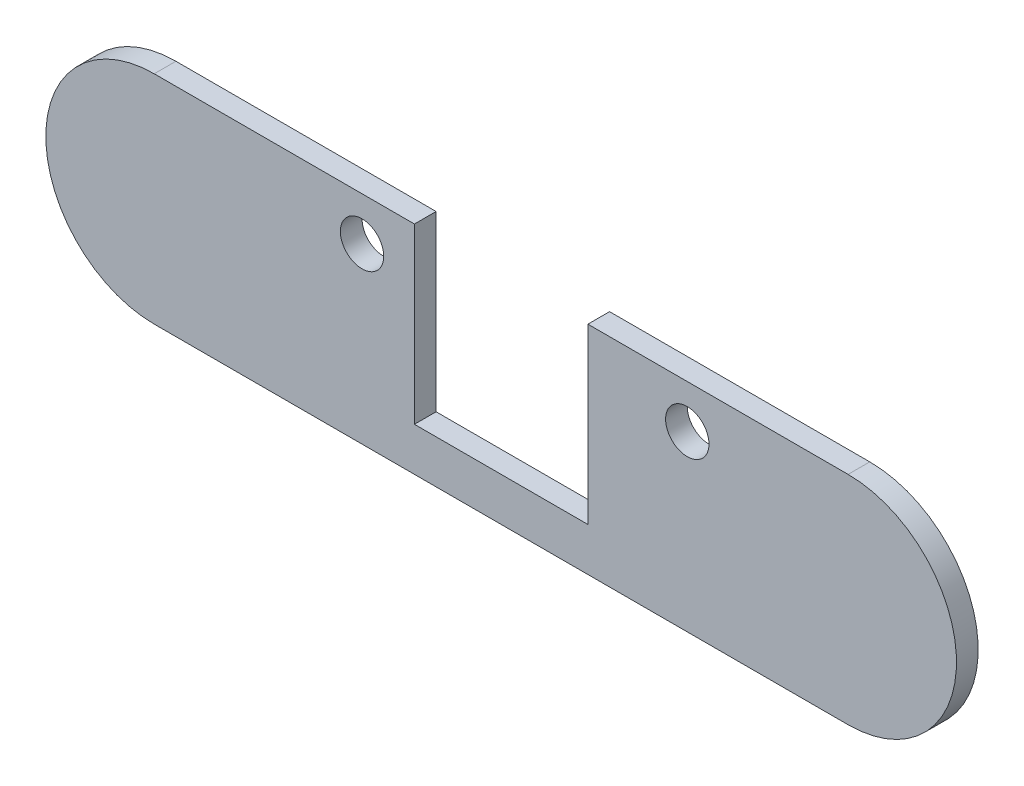
from build123d import *

# Parameters (mm, degrees)
ESQUISSE1_R             = 5
BOSS_EXTRU_1_DEPTH      = 5
ESQUISSE2_W             = 40
ESQUISSE2_H             = 40
ENL_V_MAT_EXTRU_1_DEPTH = 5


with BuildPart() as part:
    # Esquisse1 → Boss.-Extru.1 (new body)
    with BuildSketch(Plane.XY):
        with BuildLine():
            Line((0, 25), (160, 25))
            ThreePointArc((160, 25), (185, 0), (160, -25))
            Line((160, -25), (0, -25))
            ThreePointArc((0, -25), (-25, 0), (0, 25))
        make_face()
        with Locations((122.919007565, 15)):
            Circle(ESQUISSE1_R, mode=Mode.SUBTRACT)
        with Locations((47.919007565, 15)):
            Circle(ESQUISSE1_R, mode=Mode.SUBTRACT)
    extrude(amount=BOSS_EXTRU_1_DEPTH)

    # Esquisse2 → Enlèv. mat.-Extru.1 (cut)
    with BuildSketch(Plane.XY.offset(5)):
        with Locations((80, 5)):
            Rectangle(ESQUISSE2_W, ESQUISSE2_H)
    extrude(amount=-ENL_V_MAT_EXTRU_1_DEPTH, mode=Mode.SUBTRACT)


solid = part.part
